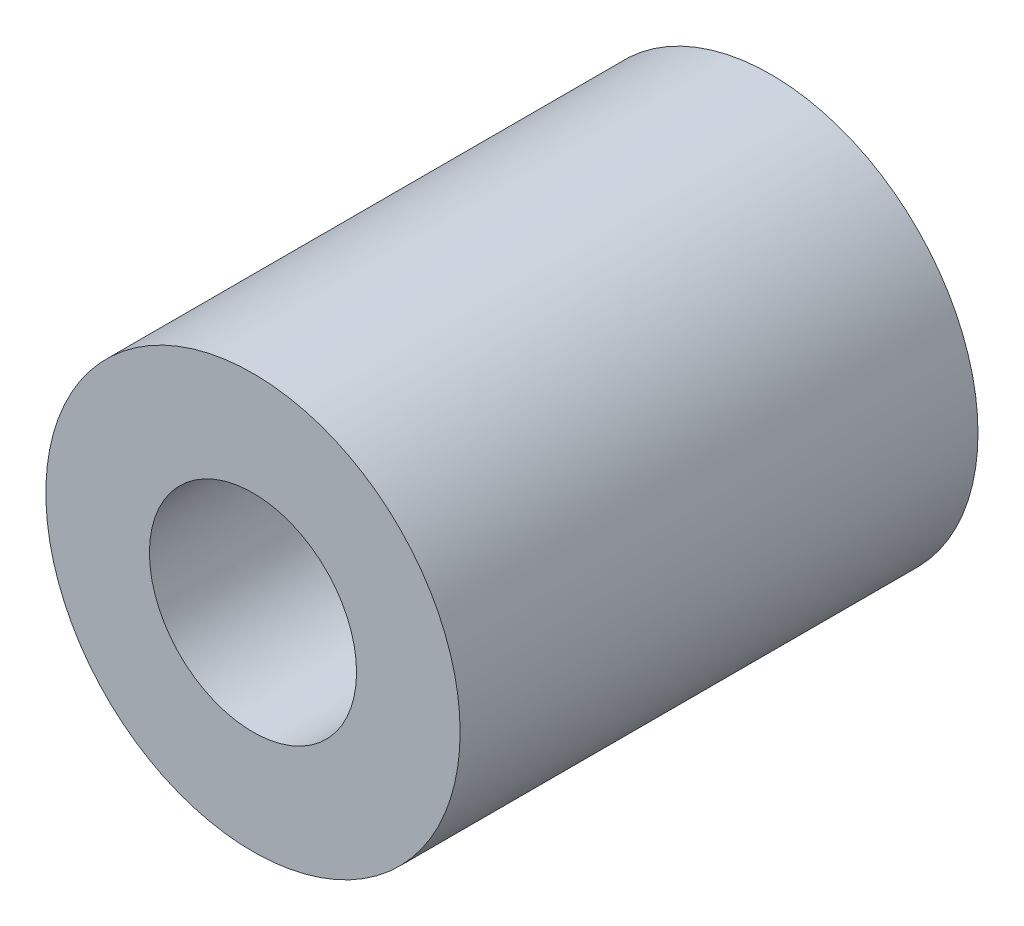
from build123d import *

# Parameters (mm, degrees)
SKETCH1_R           = 8
SKETCH1_R_2         = 4
BOSS_EXTRUDE1_DEPTH = 10


with BuildPart() as part:
    # Sketch1 → Boss-Extrude1 (new, symmetric)
    with BuildSketch(Plane.XY):
        Circle(SKETCH1_R)
        Circle(SKETCH1_R_2, mode=Mode.SUBTRACT)
    extrude(amount=BOSS_EXTRUDE1_DEPTH, both=True)


solid = part.part
